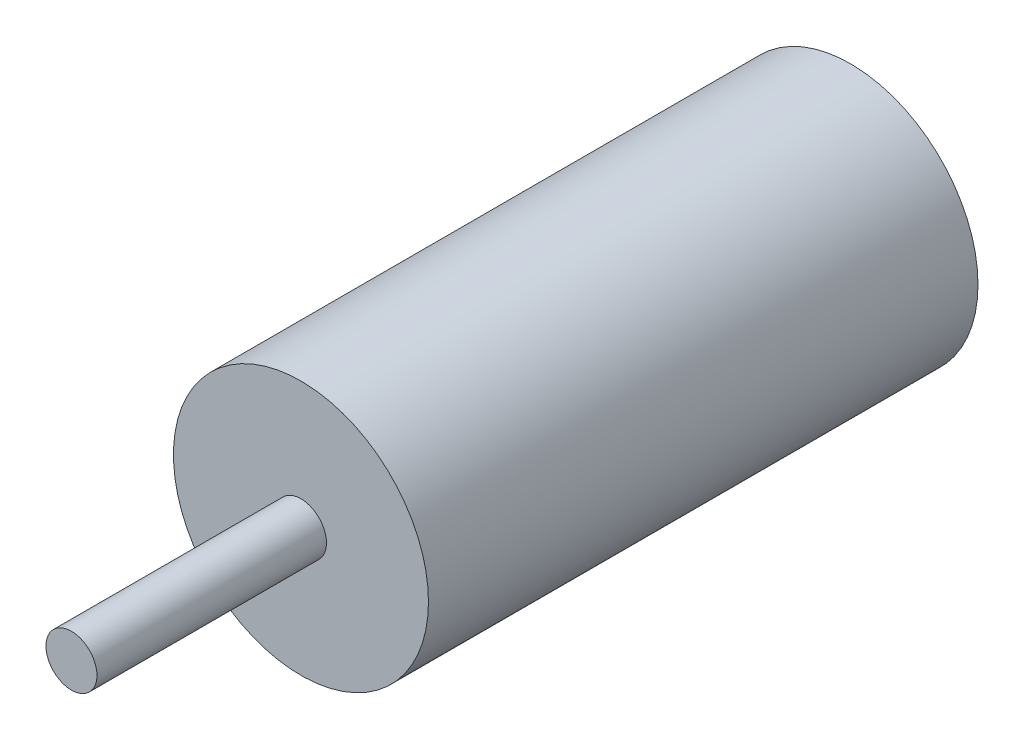
from build123d import *

# Parameters (mm, degrees)
SKETCH2_R           = 10
BOSS_EXTRUDE1_DEPTH = 43.1
SKETCH3_R           = 2
BOSS_EXTRUDE2_DEPTH = 18


with BuildPart() as part:
    # Sketch2 → Boss-Extrude1 (new body)
    with BuildSketch(Plane.XY):
        Circle(SKETCH2_R)
    extrude(amount=BOSS_EXTRUDE1_DEPTH)

    # Sketch3 → Boss-Extrude2 (add)
    with BuildSketch(Plane.XY.offset(43.1)):
        Circle(SKETCH3_R)
    extrude(amount=BOSS_EXTRUDE2_DEPTH)


solid = part.part
